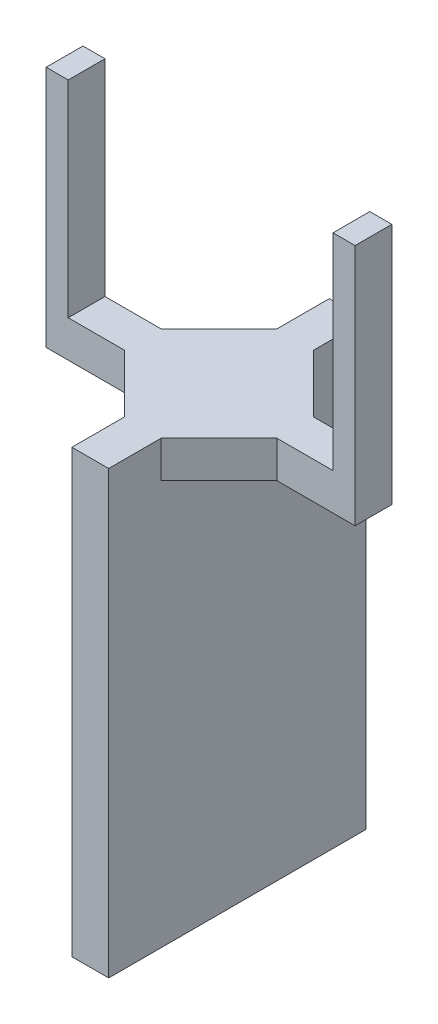
from build123d import *

# Parameters (mm, degrees)
BOSS_EXTRUDE1_DEPTH  = 3.175
MIRROR2_COPY_1_DEPTH = 3.175
SKETCH2_W            = 44.45
SKETCH2_H            = 76.2
BOSS_EXTRUDE2_DEPTH  = 3.175
CHAMFER1_SIZE        = 10


with BuildPart() as part:
    # Sketch1 → Boss-Extrude1 (new body)
    with BuildSketch(Plane.XY):
        Polygon((0, -6.997959184), (0, -0.647959184), (-22.86, -0.647959184), (-22.86, 34.912040816), (-26.67, 34.912040816), (-26.67, -6.997959184), align=None)
    boss_extrude1 = extrude(amount=BOSS_EXTRUDE1_DEPTH)

    # Mirror1: Boss-Extrude1 across plane
    add(boss_extrude1.mirror(Plane.XY))

    # Mirror2: Boss-Extrude1 across plane
    add(boss_extrude1.mirror(Plane(origin=(0, 0, 0), x_dir=(0, 0, 1), z_dir=(1, 0, 0))))

    # Mirror2 copy 1 sketch → Mirror2 copy 1 (add)
    with BuildSketch(Plane(origin=(0, 0, 0), x_dir=(-1, 0, 0), z_dir=(0, 0, -1))):
        Polygon((0, -6.997959184), (0, -0.647959184), (-22.86, -0.647959184), (-22.86, 34.912040816), (-26.67, 34.912040816), (-26.67, -6.997959184), align=None)
    extrude(amount=MIRROR2_COPY_1_DEPTH)

    # Sketch2 → Boss-Extrude2 (add)
    with BuildSketch(Plane(origin=(0, 0, 0), x_dir=(0, 0, -1), z_dir=(1, 0, 0))):
        with Locations((0, -38.747959184)):
            Rectangle(SKETCH2_W, SKETCH2_H)
    boss_extrude2 = extrude(amount=BOSS_EXTRUDE2_DEPTH)

    # Mirror3: Boss-Extrude2 across plane
    add(boss_extrude2.mirror(Plane(origin=(0, 0, 0), x_dir=(0, 0, 1), z_dir=(1, 0, 0))))

    # Chamfer1
    chamfer1_edges = [part.edges().sort_by_distance(p)[0] for p in [
        (3.175, -3.822959184, -3.175),
        (3.175, -3.822959184, 3.175),
        (-3.175, -3.822959184, -3.175),
        (-3.175, -3.822959184, 3.175),
    ]]
    chamfer(chamfer1_edges, length=CHAMFER1_SIZE)


solid = part.part
